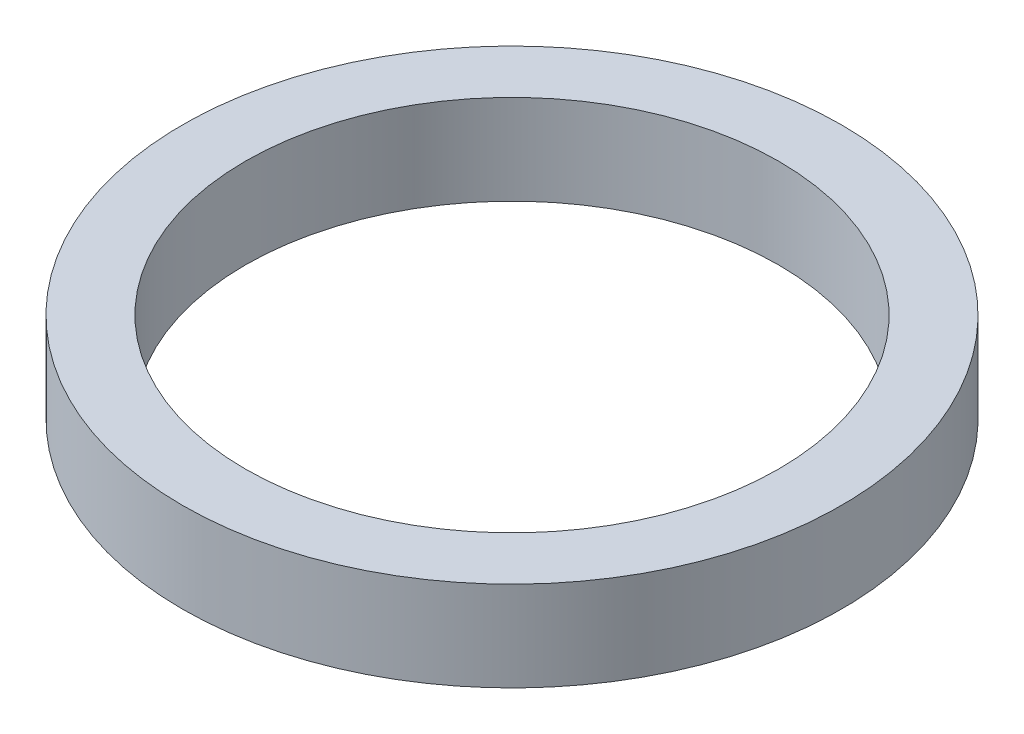
from build123d import *

# Parameters (mm, degrees)
SKETCH1_R           = 11
SKETCH1_R_2         = 8.9
BOSS_EXTRUDE1_DEPTH = 3


with BuildPart() as part:
    # Sketch1 → Boss-Extrude1 (new body)
    with BuildSketch(Plane(origin=(0, 0, 0), x_dir=(1, 0, 0), z_dir=(0, 1, 0))):
        with Locations(Location((0, 0, 0), (0, 0, 270))):
            Circle(SKETCH1_R)
        with Locations(Location((0, 0, 0), (0, 0, 270))):
            Circle(SKETCH1_R_2, mode=Mode.SUBTRACT)
    extrude(amount=BOSS_EXTRUDE1_DEPTH)


solid = part.part
